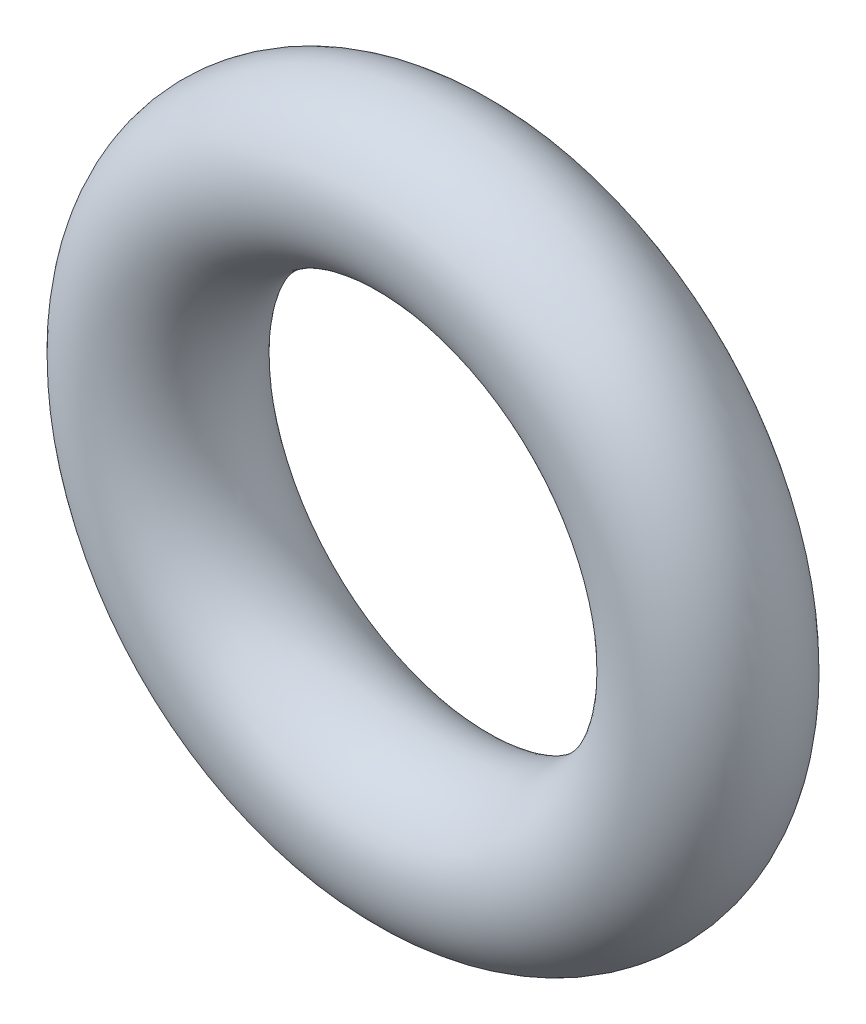
from build123d import *

# Parameters (mm, degrees)
SKETCH1_R = 0.5


with BuildPart() as part:
    # Sketch1 → Revolve1 (revolve)
    with BuildSketch(Plane(origin=(0, 0, 0), x_dir=(0, -1, 0), z_dir=(1, 0, 0))):
        with Locations((1.75, 0)):
            Circle(SKETCH1_R)
    revolve(axis=Axis((0, 0, 0.5), (0, 0, -1)))


solid = part.part
